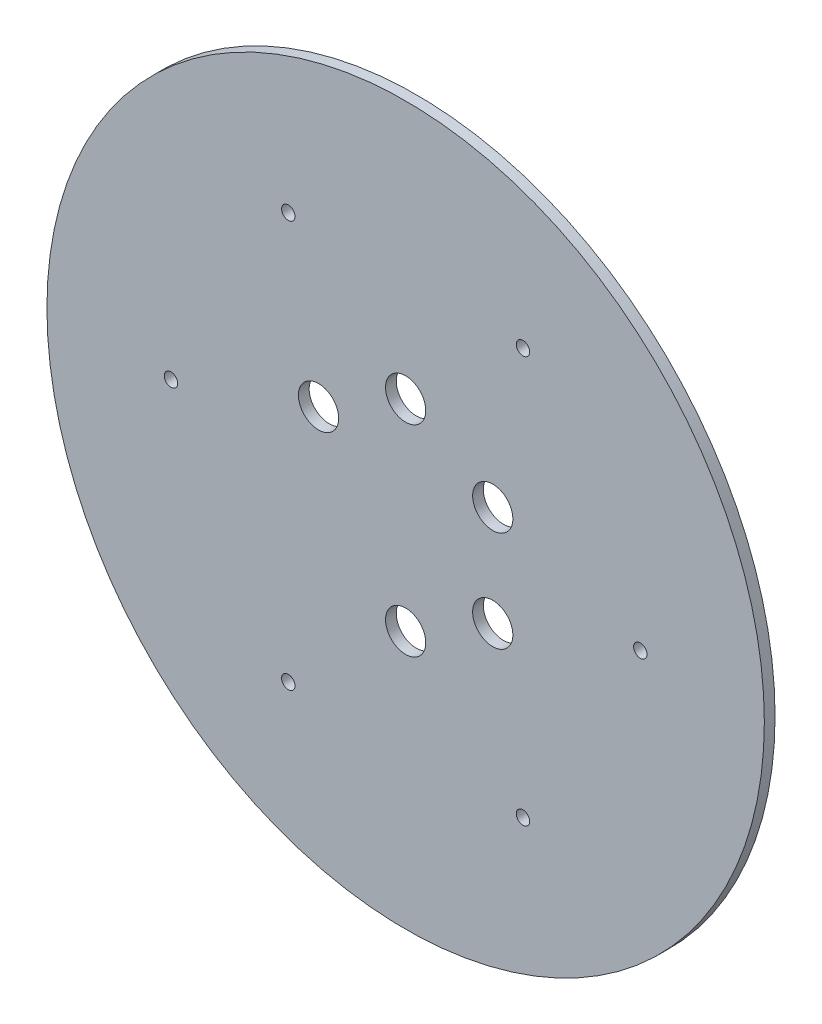
from build123d import *

# Parameters (mm, degrees)
ESQUISSE1_R        = 53.5
ESQUISSE1_R_2      = 1
ESQUISSE1_R_3      = 3
BOSS_EXTRU_1_DEPTH = 1.6


with BuildPart() as part:
    # Esquisse1 → Boss.-Extru.1 (new body)
    with BuildSketch(Plane.XY):
        Circle(ESQUISSE1_R)
        with Locations((35, 0)):
            Circle(ESQUISSE1_R_2, mode=Mode.SUBTRACT)
        with Locations((17.5, -30.310889132)):
            Circle(ESQUISSE1_R_2, mode=Mode.SUBTRACT)
        with Locations((-17.5, -30.310889132)):
            Circle(ESQUISSE1_R_2, mode=Mode.SUBTRACT)
        with Locations((-35, 0)):
            Circle(ESQUISSE1_R_2, mode=Mode.SUBTRACT)
        with Locations((-17.5, 30.310889132)):
            Circle(ESQUISSE1_R_2, mode=Mode.SUBTRACT)
        with Locations((17.5, 30.310889132)):
            Circle(ESQUISSE1_R_2, mode=Mode.SUBTRACT)
        with Locations((0, -15)):
            Circle(ESQUISSE1_R_3, mode=Mode.SUBTRACT)
        with Locations((12.990381057, -7.5)):
            Circle(ESQUISSE1_R_3, mode=Mode.SUBTRACT)
        with Locations((12.990381057, 7.5)):
            Circle(ESQUISSE1_R_3, mode=Mode.SUBTRACT)
        with Locations((0, 15)):
            Circle(ESQUISSE1_R_3, mode=Mode.SUBTRACT)
        with Locations((-12.990381057, 7.5)):
            Circle(ESQUISSE1_R_3, mode=Mode.SUBTRACT)
    extrude(amount=BOSS_EXTRU_1_DEPTH)


solid = part.part
